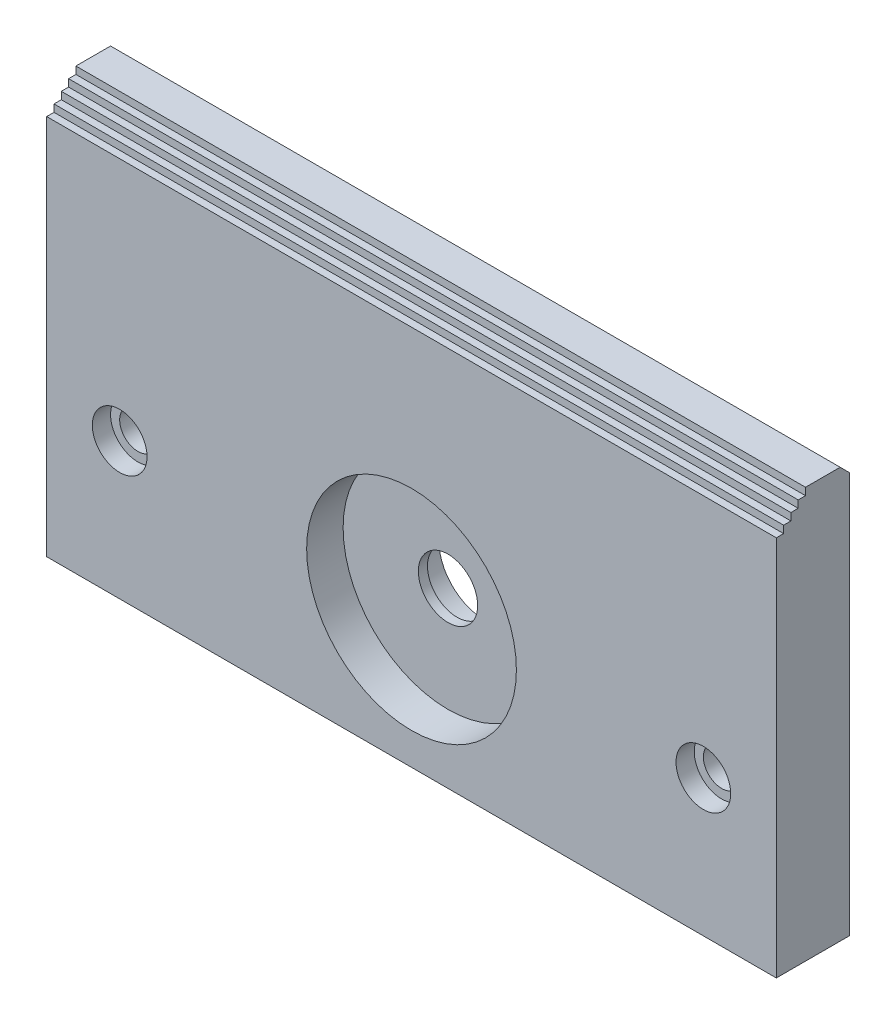
from build123d import *

# Parameters (mm, degrees)
SKETCH_1_W                     = 80
SKETCH_1_H                     = 60
EXTRUDE_1_DEPTH                = 8
HOLE_WIZARD_M3_5_1_D           = 4
HOLE_WIZARD_M3_5_1_CBORE_D     = 6
HOLE_WIZARD_M3_5_1_CBORE_DEPTH = 2
SKETCH_14_W                    = 80
SKETCH_14_H                    = 2
SKETCH_14_W_2                  = 2
SKETCH_14_H_2                  = 16
CUT_EXTRUDE_1_DEPTH            = 1
CUT_EXTRUDE_2_REACH            = 92.174
SKETCH_15_R                    = 3.25
SKETCH_17_R                    = 11.5
CUT_EXTRUDE_4_DEPTH            = 4
SKETCH_18_R                    = 5
CUT_EXTRUDE_5_DEPTH            = 3
CHAMFER_1_SIZE                 = 1.499999999
CHAMFER_1_SIZE2                = 1.500000001
CHAMFER_2_SIZE                 = 1
SKETCH_20_W                    = 80
SKETCH_20_H                    = 6
CUT_EXTRUDE_6_DEPTH            = 1
SKETCH_21_W                    = 80
SKETCH_21_H                    = 4
CUT_EXTRUDE_7_DEPTH            = 1
SKETCH_22_W                    = 80
SKETCH_22_H                    = 2
CUT_EXTRUDE_8_DEPTH            = 1
SKETCH_23_R                    = 1
CUT_EXTRUDE_9_DEPTH            = 1
CUT_EXTRUDE_10_REACH           = 92.174
SKETCH_24_W                    = 80
SKETCH_24_H                    = 15
SKETCH_25_W                    = 80
SKETCH_25_H                    = 18
EXTRUDE_2_DEPTH                = 3
CUT_EXTRUDE_11_REACH           = 92.174


with BuildPart() as part:
    # 草图1 → 凸台-拉伸1 (new body)
    with BuildSketch(Plane.XY.offset(8)):
        with Locations((40, 10.833333333)):
            Rectangle(SKETCH_1_W, SKETCH_1_H)
    extrude(amount=-EXTRUDE_1_DEPTH)

    # M3.5 六角头机械螺钉的柱形沉头孔1 (through all)
    with Locations(Plane.XY.offset(8)):
        with Locations((8, 10.833333333), (72, 10.833333333)):
            CounterBoreHole(HOLE_WIZARD_M3_5_1_D / 2, HOLE_WIZARD_M3_5_1_CBORE_D / 2, HOLE_WIZARD_M3_5_1_CBORE_DEPTH)

    # 草图14 → 切除-拉伸1 (cut)
    with BuildSketch(Plane.XY.offset(8)):
        with Locations((40, 37.833333333)):
            Rectangle(SKETCH_14_W, SKETCH_14_H)
        Polygon((15, 40.833333333), (31, 24.833333333), (32.414213562, 26.247546896), (16.414213562, 42.247546896), align=None)
        with Locations((7, 32.833333333)):
            Rectangle(SKETCH_14_W_2, SKETCH_14_H_2)
        with Locations((40, 32.833333333)):
            Rectangle(SKETCH_14_W_2, SKETCH_14_H_2)
        with Locations((73, 32.833333333)):
            Rectangle(SKETCH_14_W_2, SKETCH_14_H_2)
        Polygon((47.585786438, 26.247546896), (63.585786438, 42.247546896), (65, 40.833333333), (49, 24.833333333), align=None)
    extrude(amount=-CUT_EXTRUDE_1_DEPTH, mode=Mode.SUBTRACT)

    # 草图15 → 切除-拉伸2 (cut, up to next)
    with BuildSketch(Plane.XY.offset(8), mode=Mode.PRIVATE) as cut_extrude_2_sk1:
        with Locations((40, 10.833333333)):
            Circle(SKETCH_15_R)
    cut_extrude_2_tool1 = extrude(cut_extrude_2_sk1.sketch, amount=-CUT_EXTRUDE_2_REACH, mode=Mode.PRIVATE) & part.part
    add(cut_extrude_2_tool1.solids().sort_by_distance((40, 10.833333, 8))[0], mode=Mode.SUBTRACT)

    # 草图17 → 切除-拉伸4 (cut)
    with BuildSketch(Plane.XY.offset(8)):
        with Locations((40, 10.833333333)):
            Circle(SKETCH_17_R)
    extrude(amount=-CUT_EXTRUDE_4_DEPTH, mode=Mode.SUBTRACT)

    # 草图18 → 切除-拉伸5 (cut)
    with BuildSketch(Plane(origin=(0, 0, 0), x_dir=(-1, 0, 0), z_dir=(0, 0, -1))):
        with Locations((-40, 10.833333333)):
            Circle(SKETCH_18_R)
    extrude(amount=-CUT_EXTRUDE_5_DEPTH, mode=Mode.SUBTRACT)

    # 倒角1
    chamfer_1_edges = [part.edges().sort_by_distance(p)[0] for p in [
        (74, 10.833333333, 0),
        (10, 10.833333333, 0),
    ]]
    chamfer_1_side = [part.faces().sort_by_distance(p)[0] for p in [
        (79, 10.833333333, 0),
    ]]
    chamfer(chamfer_1_edges, length=CHAMFER_1_SIZE, length2=CHAMFER_1_SIZE2, reference=chamfer_1_side[0])

    # 倒角2
    chamfer_2_edges = [part.edges().sort_by_distance(p)[0] for p in [
        (40, 40.833333333, 0),
    ]]
    chamfer(chamfer_2_edges, length=CHAMFER_2_SIZE)

    # 草图20 → 切除-拉伸6 (cut)
    with BuildSketch(Plane.XY.offset(8)):
        with Locations((40, -16.166666667)):
            Rectangle(SKETCH_20_W, SKETCH_20_H)
    extrude(amount=-CUT_EXTRUDE_6_DEPTH, mode=Mode.SUBTRACT)

    # 草图21 → 切除-拉伸7 (cut)
    with BuildSketch(Plane.XY.offset(7)):
        with Locations((40, -17.166666667)):
            Rectangle(SKETCH_21_W, SKETCH_21_H)
    extrude(amount=-CUT_EXTRUDE_7_DEPTH, mode=Mode.SUBTRACT)

    # 草图22 → 切除-拉伸8 (cut)
    with BuildSketch(Plane.XY.offset(6)):
        with Locations((40, -18.166666667)):
            Rectangle(SKETCH_22_W, SKETCH_22_H)
    extrude(amount=-CUT_EXTRUDE_8_DEPTH, mode=Mode.SUBTRACT)

    # 草图23 → 切除-拉伸9 (cut)
    with BuildSketch(Plane.XY.offset(8)):
        with Locations((7, 24.833333333)):
            Circle(SKETCH_23_R)
        with Locations((31.707106781, 25.540440115)):
            Circle(SKETCH_23_R)
        with Locations((40, 24.833333333)):
            Circle(SKETCH_23_R)
        with Locations((48.292893219, 25.540440115)):
            Circle(SKETCH_23_R)
        with Locations((73, 24.833333333)):
            Circle(SKETCH_23_R)
    extrude(amount=-CUT_EXTRUDE_9_DEPTH, mode=Mode.SUBTRACT)

    # 草图24 → 切除-拉伸10 (cut, up to next)
    with BuildSketch(Plane.XY.offset(8), mode=Mode.PRIVATE) as cut_extrude_10_sk1:
        with Locations((40, -11.666666667)):
            Rectangle(SKETCH_24_W, SKETCH_24_H)
    cut_extrude_10_tool1 = extrude(cut_extrude_10_sk1.sketch, amount=-CUT_EXTRUDE_10_REACH, mode=Mode.PRIVATE) & part.part
    add(cut_extrude_10_tool1.solids().sort_by_distance((40, -11.666667, 8))[0], mode=Mode.SUBTRACT)

    # 草图25 → 凸台-拉伸2 (add)
    with BuildSketch(Plane.XY.offset(8)):
        with Locations((40, 31.833333333)):
            Rectangle(SKETCH_25_W, SKETCH_25_H)
    extrude(amount=-EXTRUDE_2_DEPTH)

    # 草图26 → 切除-拉伸11 (cut, up to next)
    with BuildSketch(Plane.ZY, mode=Mode.PRIVATE) as cut_extrude_11_sk1:
        Polygon((4.8, 40.833333333), (4.8, 40.033333333), (5.6, 40.033333333), (5.6, 39.233333333), (6.4, 39.233333333), (6.4, 38.433333333), (7.2, 38.433333333), (7.2, 37.633333333), (8, 37.633333333), (8, 40.833333333), align=None)
    cut_extrude_11_tool1 = extrude(cut_extrude_11_sk1.sketch, amount=-CUT_EXTRUDE_11_REACH, mode=Mode.PRIVATE) & part.part
    add(cut_extrude_11_tool1.solids().sort_by_distance((0, 39.633333, 6.8))[0], mode=Mode.SUBTRACT)


solid = part.part
